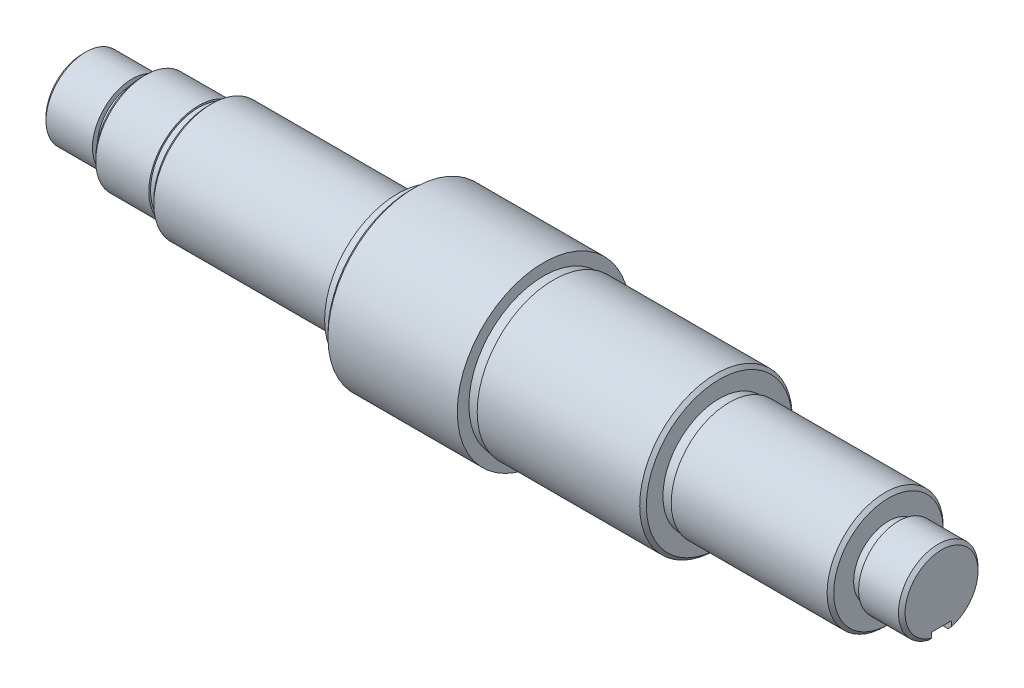
from build123d import *

# Parameters (mm, degrees)
SKETCH_1_W          = 15
SKETCH_1_H          = 12
SKETCH_1_W_2        = 3
SKETCH_1_H_2        = 10.5
SKETCH_1_H_3        = 14.5
SKETCH_1_H_4        = 17
SKETCH_1_H_5        = 22.5
CHAMFER_1_SIZE      = 1
CUT_EXTRUDE_1_DEPTH = 4
CUT_EXTRUDE_2_DEPTH = 5
SKETCH_5_W          = 16
SKETCH_5_H          = 6
CUT_EXTRUDE_3_DEPTH = 3


with BuildPart() as part:
    # 草图1 → 旋转1 (revolve)
    with BuildSketch(Plane(origin=(0, 0, 0), x_dir=(1, 0, 0), z_dir=(0, 1, 0))):
        with Locations((-96.778500263, 113.072139402)):
            Rectangle(SKETCH_1_W, SKETCH_1_H)
        with Locations((-87.778500263, 113.822139402)):
            Rectangle(SKETCH_1_W_2, SKETCH_1_H_2)
        Polygon((-69.278500263, 119.072139402), (-69.278500263, 104.072139402), (-86.278500263, 104.072139402), (-86.278500263, 108.572139402), (-86.278500263, 119.072139402), align=None)
        with Locations((-67.778500263, 111.822139402)):
            Rectangle(SKETCH_1_W_2, SKETCH_1_H_3)
        Polygon((-66.278500263, 119.072139402), (-66.278500263, 104.572139402), (-66.278500263, 101.572139402), (-12.278500263, 101.572139402), (-12.278500263, 102.072139402), (-12.278500263, 119.072139402), align=None)
        with Locations((-10.778500263, 110.572139402)):
            Rectangle(SKETCH_1_W_2, SKETCH_1_H_4)
        Polygon((-5.278500263, 119.072139402), (-9.278500263, 119.072139402), (-9.278500263, 102.072139402), (-9.278500263, 97.072139402), (-5.278500263, 97.072139402), align=None)
        Polygon((34.721499737, 119.072139402), (-5.278500263, 119.072139402), (-5.278500263, 97.072139402), (-5.278500263, 93.072139402), (34.721499737, 93.072139402), (34.721499737, 96.572139402), align=None)
        with Locations((36.221499737, 107.822139402)):
            Rectangle(SKETCH_1_W_2, SKETCH_1_H_5)
        Polygon((87.721499737, 119.072139402), (37.721499737, 119.072139402), (37.721499737, 96.572139402), (37.721499737, 96.072139402), (87.721499737, 96.072139402), (87.721499737, 102.072139402), align=None)
        with Locations((89.221499737, 110.572139402)):
            Rectangle(SKETCH_1_W_2, SKETCH_1_H_4)
        Polygon((138.721499737, 119.072139402), (90.721499737, 119.072139402), (90.721499737, 102.072139402), (90.721499737, 101.572139402), (138.721499737, 101.572139402), (138.721499737, 104.257707549), (138.721499737, 107.072139402), (138.721499737, 108.572139402), align=None)
        with Locations((140.221499737, 113.822139402)):
            Rectangle(SKETCH_1_W_2, SKETCH_1_H_2)
        Polygon((154.721499737, 119.072139402), (141.721499737, 119.072139402), (141.721499737, 108.572139402), (141.721499737, 107.072139402), (154.721499737, 107.072139402), align=None)
    revolve(axis=Axis((-109.712030386, 0, -119.072139402), (1, 0, 0)))

    # 倒角1
    chamfer_1_edges = [part.edges().sort_by_distance(p)[0] for p in [
        (-104.278500263, 0, -131.072139402),
        (154.721499737, 0, -131.072139402),
        (138.721499737, 0, -136.572139402),
        (87.721499737, 0, -142.072139402),
        (-5.278500263, 0, -145.072139402),
        (-66.278500263, 0, -136.572139402),
        (-86.278500263, 0, -134.072139402),
    ]]
    chamfer(chamfer_1_edges, length=CHAMFER_1_SIZE)

    # 草图2 → 切除-拉伸1 (cut)
    with BuildSketch(Plane(origin=(0, -15, 0), x_dir=(-1, 0, 0), z_dir=(0, -1, 0))):
        with BuildLine():
            Line((78.278500263, 115.072139402), (76.278500263, 115.072139402))
            ThreePointArc((76.278500263, 115.072139402), (72.278500263, 119.072139402), (76.278500263, 123.072139402))
            Line((76.278500263, 123.072139402), (78.278500263, 123.072139402))
            ThreePointArc((78.278500263, 123.072139402), (82.278500263, 119.072139402), (78.278500263, 115.072139402))
        make_face()
    extrude(amount=-CUT_EXTRUDE_1_DEPTH, mode=Mode.SUBTRACT)

    # 草图3 → 切除-拉伸2 (cut)
    with BuildSketch(Plane(origin=(0, -23, 0), x_dir=(-1, 0, 0), z_dir=(0, -1, 0))):
        with BuildLine():
            Line((-48.721499737, 113.072139402), (-72.721499737, 113.072139402))
            ThreePointArc((-72.721499737, 113.072139402), (-78.721499737, 119.072139402), (-72.721499737, 125.072139402))
            Line((-72.721499737, 125.072139402), (-48.721499737, 125.072139402))
            ThreePointArc((-48.721499737, 125.072139402), (-42.721499737, 119.072139402), (-48.721499737, 113.072139402))
        make_face()
    extrude(amount=-CUT_EXTRUDE_2_DEPTH, mode=Mode.SUBTRACT)

    # 草图5 → 切除-拉伸3 (cut)
    with BuildSketch(Plane(origin=(0, -12, 0), x_dir=(-1, 0, 0), z_dir=(0, -1, 0))):
        with Locations((-146.728951344, 119.072139402)):
            Rectangle(SKETCH_5_W, SKETCH_5_H)
    extrude(amount=-CUT_EXTRUDE_3_DEPTH, mode=Mode.SUBTRACT)


solid = part.part
